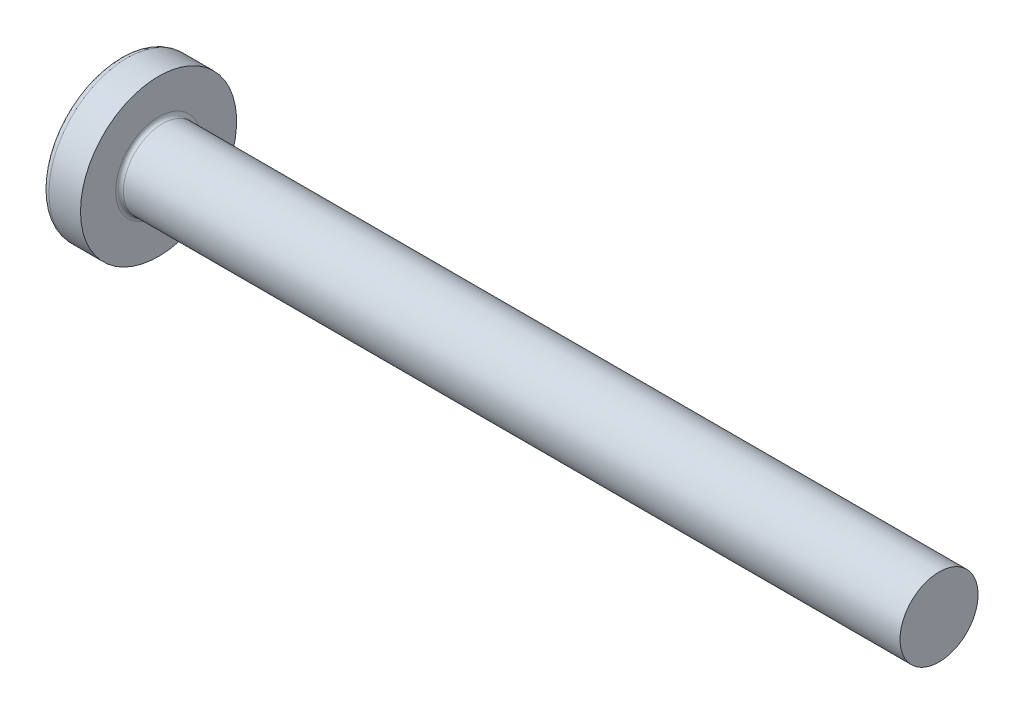
from build123d import *

# Parameters (mm, degrees)
FILLET1_R    = 0.1
RECPAT_COUNT = 2
RECPAT_ANGLE = 90


with BuildPart() as part:
    # BodySke → Base-Revolve (revolve)
    with BuildSketch(Plane.XY, mode=Mode.PRIVATE) as base_revolve_sk:
        with BuildLine():
            Line((1.6, 1), (1.6, 2))
            Line((1.6, 2), (0.790020747, 2))
            ThreePointArc((0.790020747, 2), (0.709789294, 1.981130115), (0.646379599, 1.928476821))
            ThreePointArc((0.646379599, 1.928476821), (0.165895084, 1.016959861), (0, 0))
            Line((0, 0), (21.6, 0))
            Line((21.6, 0), (21.6, 1))
            Line((21.6, 1), (1.6, 1))
        make_face()
    revolve(base_revolve_sk.sketch.rotate(Axis((0.790020747, 0, 0), (1, 0, 0)), 90), axis=Axis((0.790020747, 0, 0), (1, 0, 0)))

    # Fillet1
    fillet1_edges = [part.edges().sort_by_distance(p)[0] for p in [
        (1.6, 0, -1),
    ]]
    fillet(fillet1_edges, radius=FILLET1_R)

    # Sketch3 → Recess section 0
    with BuildSketch(Plane(origin=(0, 0, 0), x_dir=(0, 0, -1), z_dir=(1, 0, 0))):
        with BuildLine():
            Line((0.24, -1.05), (-0.24, -1.05))
            Line((-0.24, -1.05), (-0.24, 1.05))
            Line((-0.24, 1.05), (0.24, 1.05))
            Line((0.24, 1.05), (0.24, -1.05))
        make_face()
    # Sketch4 → Recess section 1
    with BuildSketch(Plane(origin=(1.42, 0, 0), x_dir=(0, 0, -1), z_dir=(1, 0, 0))):
        with BuildLine():
            Line((0.24, -0.342014235), (-0.24, -0.342014235))
            Line((-0.24, -0.342014235), (-0.24, 0.342014235))
            Line((-0.24, 0.342014235), (0.24, 0.342014235))
            Line((0.24, 0.342014235), (0.24, -0.342014235))
        make_face()
    recess = loft(mode=Mode.SUBTRACT)

    # RecPat: Recess ×2 about axis
    recpat_axis = Axis((0, 0, 0), (1, 0, 0))
    for i in range(1, RECPAT_COUNT):
        add(recess.rotate(recpat_axis, i * RECPAT_ANGLE / (RECPAT_COUNT - 1)), mode=Mode.SUBTRACT)

    # RecCorSke → RecessCore (revolve, cut)
    with BuildSketch(Plane.XY, mode=Mode.PRIVATE) as recesscore_sk:
        Polygon((0, 0), (0, 0.454796073), (1.42, 0.3555), (1.535508952, 0), align=None)
    revolve(recesscore_sk.sketch.rotate(Axis((-3.175, 0, 0), (1, 0, 0)), 13.894577695), axis=Axis((-3.175, 0, 0), (1, 0, 0)), mode=Mode.SUBTRACT)


solid = part.part
